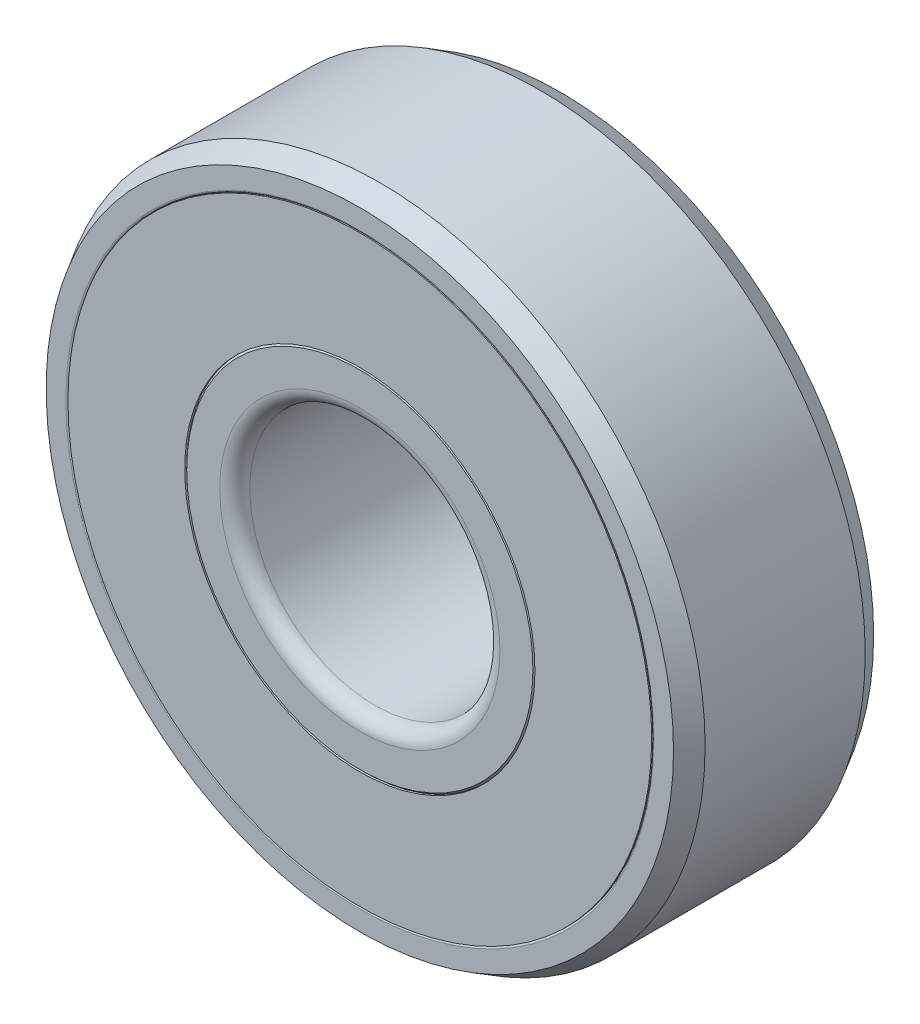
from build123d import *

# Parameters (mm, degrees)
SKETCH4_W         = 0.291666667
SKETCH4_H         = 2.333333333
CIRPATTERN1_COUNT = 7


with BuildPart() as part:
    # Sketch3 → Revolve1 (revolve)
    with BuildSketch(Plane(origin=(0, 0, 0), x_dir=(0, 0, -1), z_dir=(1, 0, 0)), mode=Mode.PRIVATE) as revolve1_sk:
        with BuildLine():
            Line((-1.6, -6.5), (1.6, -6.5))
            Line((1.6, -6.5), (2, -6.269059892))
            Line((2, -6.269059892), (2, -5.873333333))
            ThreePointArc((2, -5.873333333), (1.988284271, -5.845049062), (1.96, -5.833333333))
            Line((1.96, -5.833333333), (1.111111111, -5.833333333))
            ThreePointArc((1.111111111, -5.833333333), (0, -6.277777778), (-1.111111111, -5.833333333))
            Line((-1.111111111, -5.833333333), (-1.96, -5.833333333))
            ThreePointArc((-1.96, -5.833333333), (-1.988284271, -5.845049062), (-2, -5.873333333))
            Line((-2, -5.873333333), (-2, -6.269059892))
            Line((-2, -6.269059892), (-1.6, -6.5))
        make_face()
        with BuildLine():
            Line((-1.7, -2.5), (1.7, -2.5))
            ThreePointArc((1.7, -2.5), (1.912132034, -2.587867966), (2, -2.8))
            Line((2, -2.8), (2, -3.46))
            Line((2, -3.46), (1.96, -3.5))
            Line((1.96, -3.5), (1.111111111, -3.5))
            ThreePointArc((1.111111111, -3.5), (0, -3.055555556), (-1.111111111, -3.5))
            Line((-1.111111111, -3.5), (-1.96, -3.5))
            Line((-1.96, -3.5), (-2, -3.46))
            Line((-2, -3.46), (-2, -2.8))
            ThreePointArc((-2, -2.8), (-1.912132034, -2.587867966), (-1.7, -2.5))
        make_face()
    revolve(revolve1_sk.sketch.rotate(Axis((0, 0, 2), (0, 0, -1)), 270), axis=Axis((0, 0, 2), (0, 0, -1)))


with BuildPart() as body_2:
    # Sketch4 → Revolve2 (revolve)
    with BuildSketch(Plane(origin=(0, 0, 0), x_dir=(0, 0, -1), z_dir=(1, 0, 0)), mode=Mode.PRIVATE) as revolve2_sk:
        with Locations((-1.854166667, -4.666666667)):
            Rectangle(SKETCH4_W, SKETCH4_H)
    revolve(revolve2_sk.sketch.rotate(Axis((0, 0, 2), (0, 0, -1)), 270), axis=Axis((0, 0, 2), (0, 0, -1)))


with BuildPart() as body_3:
    # Sketch5 → Revolve3 (revolve)
    with BuildSketch(Plane(origin=(0, 0, 0), x_dir=(0, 0, -1), z_dir=(1, 0, 0))):
        with BuildLine():
            Line((0, -3.055555556), (0, -6.277777778))
            ThreePointArc((0, -6.277777778), (-1.611111111, -4.666666667), (0, -3.055555556))
        make_face()
    revolve(axis=Axis((0, 0, 0), (0, -1, 0)))


with BuildPart() as cirpattern1_1:
    # CirPattern1: pattern copy
    add(body_3.part.rotate(Axis((0, 0, 0), (0, 0, 1)), 1 * 360 / CIRPATTERN1_COUNT))


with BuildPart() as cirpattern1_2:
    # CirPattern1: pattern copy
    add(body_3.part.rotate(Axis((0, 0, 0), (0, 0, 1)), 2 * 360 / CIRPATTERN1_COUNT))


with BuildPart() as cirpattern1_3:
    # CirPattern1: pattern copy
    add(body_3.part.rotate(Axis((0, 0, 0), (0, 0, 1)), 3 * 360 / CIRPATTERN1_COUNT))


with BuildPart() as cirpattern1_4:
    # CirPattern1: pattern copy
    add(body_3.part.rotate(Axis((0, 0, 0), (0, 0, 1)), 4 * 360 / CIRPATTERN1_COUNT))


with BuildPart() as cirpattern1_5:
    # CirPattern1: pattern copy
    add(body_3.part.rotate(Axis((0, 0, 0), (0, 0, 1)), 5 * 360 / CIRPATTERN1_COUNT))


with BuildPart() as cirpattern1_6:
    # CirPattern1: pattern copy
    add(body_3.part.rotate(Axis((0, 0, 0), (0, 0, 1)), 6 * 360 / CIRPATTERN1_COUNT))


solid = Compound([part.part, body_2.part, body_3.part, cirpattern1_1.part, cirpattern1_2.part, cirpattern1_3.part, cirpattern1_4.part, cirpattern1_5.part, cirpattern1_6.part])
